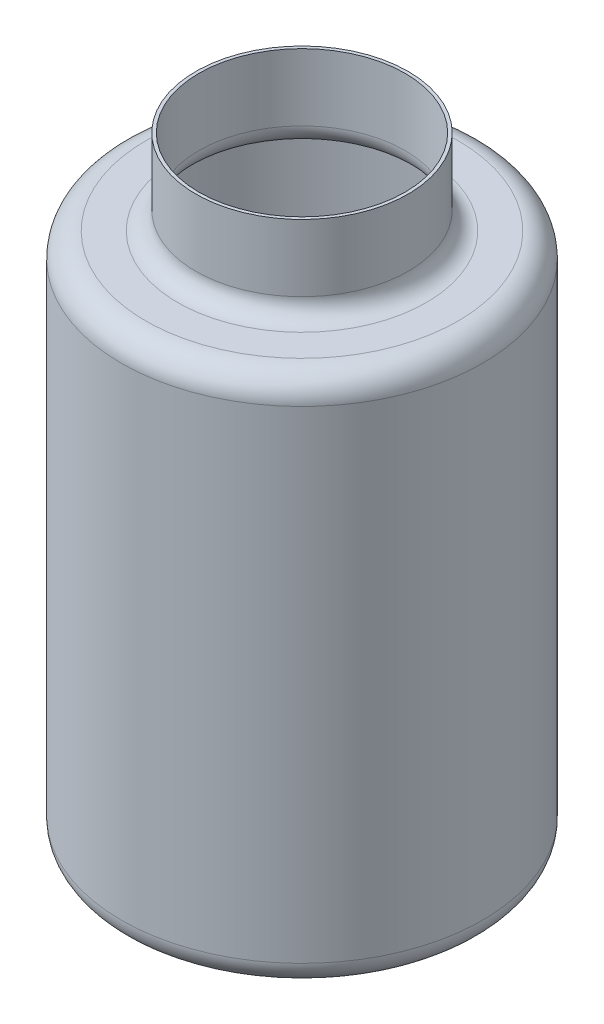
from build123d import *


with BuildPart() as part:
    # Sketch2 → Revolve1 (revolve)
    with BuildSketch(Plane.XY, mode=Mode.PRIVATE) as revolve1_sk:
        with BuildLine():
            Line((24.638, 146.558), (24.638, 130.556))
            ThreePointArc((24.638, 130.556), (26.125897552, 126.963897552), (29.718, 125.476))
            Line((29.718, 125.476), (37.338, 125.476))
            ThreePointArc((37.338, 125.476), (40.930102448, 123.988102448), (42.418, 120.396))
            Line((42.418, 120.396), (42.418, 5.08))
            ThreePointArc((42.418, 5.08), (40.930102448, 1.487897552), (37.338, 0))
            Line((37.338, 0), (0, 0))
            Line((0, 0), (0, -0.762))
            Line((0, -0.762), (37.338, -0.762))
            ThreePointArc((37.338, -0.762), (41.468917816, 0.949082184), (43.18, 5.08))
            Line((43.18, 5.08), (43.18, 120.396))
            ThreePointArc((43.18, 120.396), (41.468917816, 124.526917816), (37.338, 126.238))
            Line((37.338, 126.238), (29.718, 126.238))
            ThreePointArc((29.718, 126.238), (26.664712919, 127.502712919), (25.4, 130.556))
            Line((25.4, 130.556), (25.4, 146.558))
            Line((25.4, 146.558), (24.638, 146.558))
        make_face()
    revolve(revolve1_sk.sketch.rotate(Axis((0, -97.378122646, 0), (0, 1, 0)), 90), axis=Axis((0, -97.378122646, 0), (0, 1, 0)))


solid = part.part
